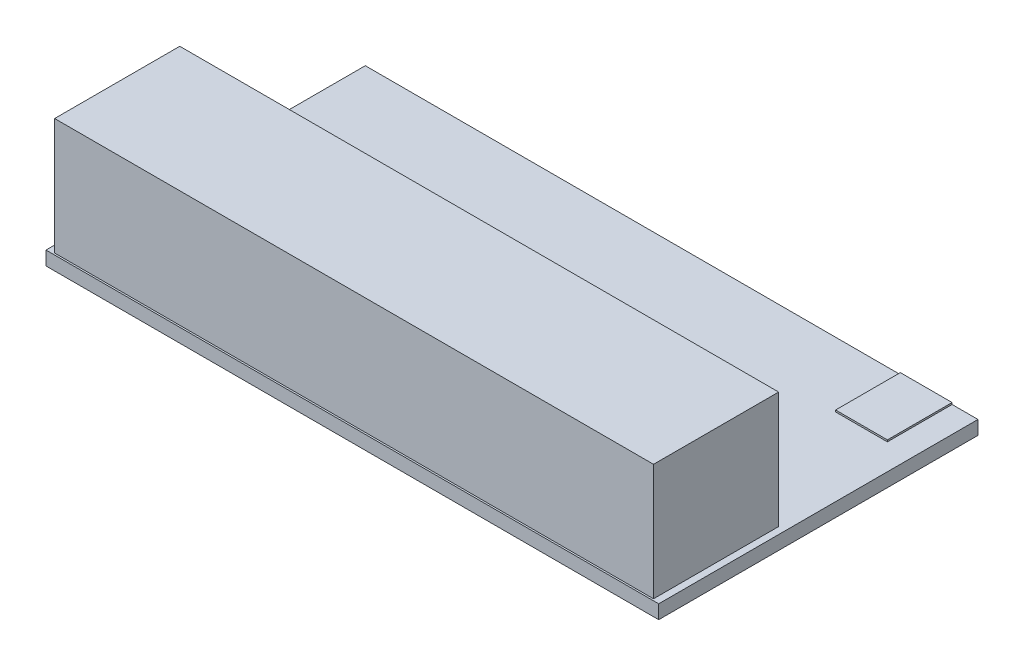
from build123d import *

# Parameters (mm, degrees)
SKETCH1_W           = 71
SKETCH1_H           = 37
BOSS_EXTRUDE1_DEPTH = 1.6
SKETCH2_W           = 69.4
SKETCH2_H           = 14.5
BOSS_EXTRUDE2_DEPTH = 13.5
SKETCH3_W           = 6
SKETCH3_H           = 7.5
BOSS_EXTRUDE3_DEPTH = 0.2


with BuildPart() as part:
    # Sketch1 → Boss-Extrude1 (new body)
    with BuildSketch(Plane(origin=(0, 0, 0), x_dir=(1, 0, 0), z_dir=(0, 1, 0))):
        with Locations((35.5, 18.5)):
            Rectangle(SKETCH1_W, SKETCH1_H)
    extrude(amount=BOSS_EXTRUDE1_DEPTH)

    # Sketch2 → Boss-Extrude2 (add)
    with BuildSketch(Plane(origin=(0, 1.6, 0), x_dir=(1, 0, 0), z_dir=(0, 1, 0))):
        with Locations((35.5, 7.45)):
            Rectangle(SKETCH2_W, SKETCH2_H)
    extrude(amount=BOSS_EXTRUDE2_DEPTH)

    # Sketch3 → Boss-Extrude3 (add)
    with BuildSketch(Plane(origin=(0, 1.6, 0), x_dir=(1, 0, 0), z_dir=(0, 1, 0))):
        with Locations((65, 33.25)):
            Rectangle(SKETCH3_W, SKETCH3_H)
    extrude(amount=BOSS_EXTRUDE3_DEPTH)


solid = part.part
